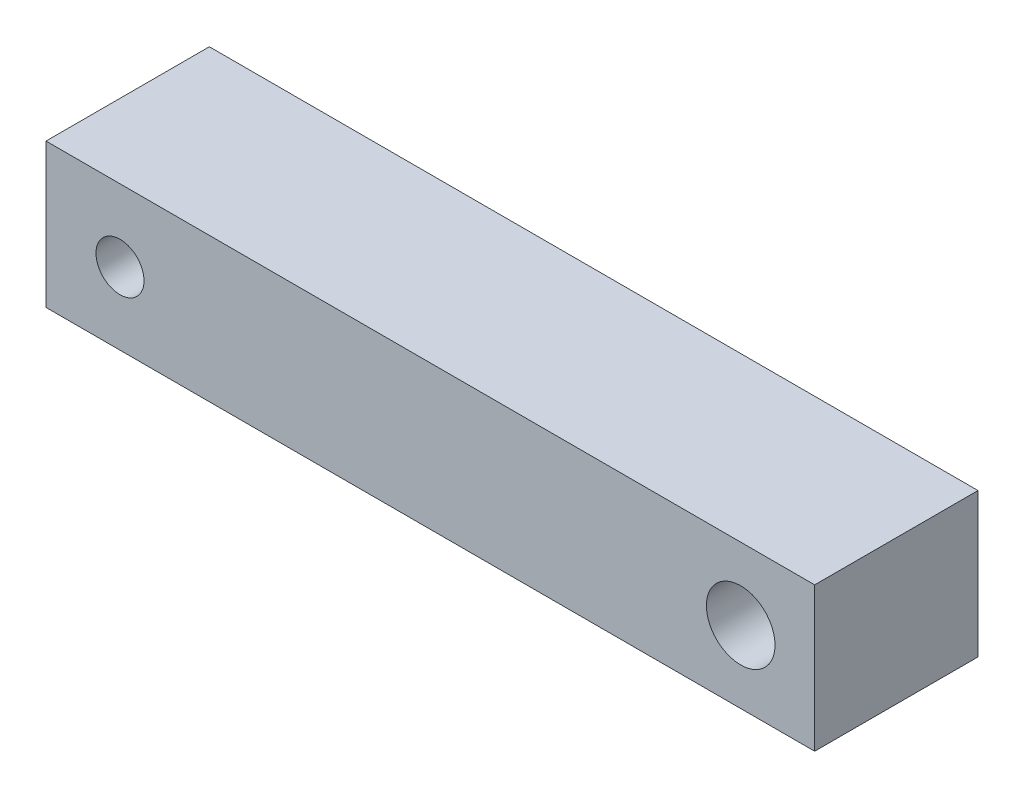
from build123d import *

# Parameters (mm, degrees)
BOSS_EXTRUDE1_START = 10
SKETCH1_W           = 80
SKETCH1_H           = 15
SKETCH1_R           = 3.57
SKETCH1_R_2         = 2.5
BOSS_EXTRUDE1_DEPTH = 17


with BuildPart() as part:
    # Sketch1 → Boss-Extrude1 (new body)
    with BuildSketch(Plane.XY.offset(BOSS_EXTRUDE1_START)):
        with Locations((0, 33.230865602)):
            Rectangle(SKETCH1_W, SKETCH1_H)
        with Locations((32.3, 33.230865461)):
            Circle(SKETCH1_R, mode=Mode.SUBTRACT)
        with Locations((-32.3, 33.230865744)):
            Circle(SKETCH1_R_2, mode=Mode.SUBTRACT)
    extrude(amount=BOSS_EXTRUDE1_DEPTH)


solid = part.part
